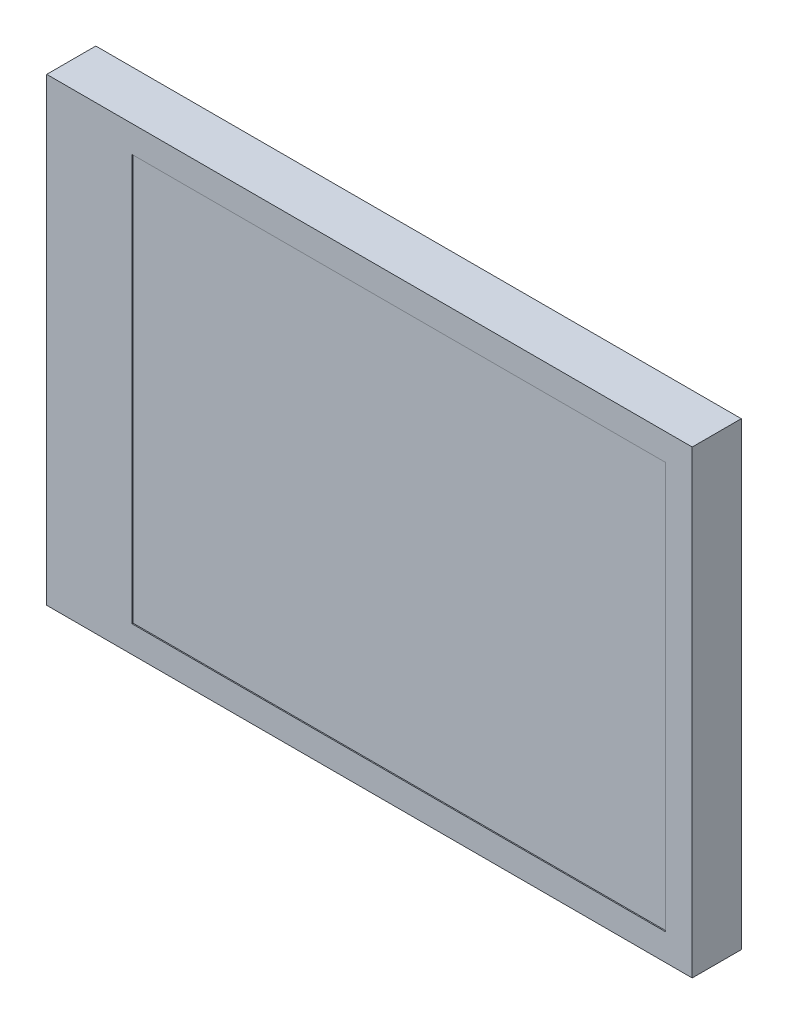
from build123d import *

# Parameters (mm, degrees)
ESQUISSE1_W             = 60.5
ESQUISSE1_H             = 43.1
BOSS_EXTRU_1_DEPTH      = 4.6
ESQUISSE2_W             = 50
ESQUISSE2_H             = 38.1
ENL_V_MAT_EXTRU_1_DEPTH = 0.1
ESQUISSE3_W             = 7.5
ESQUISSE3_H             = 5.3
BOSS_EXTRU_2_DEPTH      = 2.5
ESQUISSE4_W             = 5.6
ESQUISSE4_H             = 17.6
BOSS_EXTRU_3_DEPTH      = 4.1
ESQUISSE5_W             = 14.8
ESQUISSE5_H             = 15.3
BOSS_EXTRU_4_DEPTH      = 2


with BuildPart() as part:
    # Esquisse1 → Boss.-Extru.1 (new body)
    with BuildSketch(Plane.XY):
        Rectangle(ESQUISSE1_W, ESQUISSE1_H)
    extrude(amount=BOSS_EXTRU_1_DEPTH)

    # Esquisse2 → Enlèv. mat.-Extru.1 (cut)
    with BuildSketch(Plane.XY.offset(4.6)):
        with Locations((2.75, 0)):
            Rectangle(ESQUISSE2_W, ESQUISSE2_H)
    extrude(amount=-ENL_V_MAT_EXTRU_1_DEPTH, mode=Mode.SUBTRACT)


with BuildPart() as body_2:
    # Esquisse3 → Boss.-Extru.2 (new body)
    with BuildSketch(Plane(origin=(0, 0, 0), x_dir=(-1, 0, 0), z_dir=(0, 0, -1))):
        with Locations((24.5, -18.9)):
            Rectangle(ESQUISSE3_W, ESQUISSE3_H)
    extrude(amount=BOSS_EXTRU_2_DEPTH)


with BuildPart() as body_3:
    # Esquisse4 → Boss.-Extru.3 (new body)
    with BuildSketch(Plane(origin=(0, 0, 0), x_dir=(-1, 0, 0), z_dir=(0, 0, -1))):
        with Locations((27.45, 5.85)):
            Rectangle(ESQUISSE4_W, ESQUISSE4_H)
    extrude(amount=BOSS_EXTRU_3_DEPTH)


with BuildPart() as body_4:
    # Esquisse5 → Boss.-Extru.4 (new body)
    with BuildSketch(Plane(origin=(0, 0, 0), x_dir=(-1, 0, 0), z_dir=(0, 0, -1))):
        with Locations((-20.85, -13.9)):
            Rectangle(ESQUISSE5_W, ESQUISSE5_H)
    extrude(amount=BOSS_EXTRU_4_DEPTH)


solid = Compound([part.part, body_2.part, body_3.part, body_4.part])
